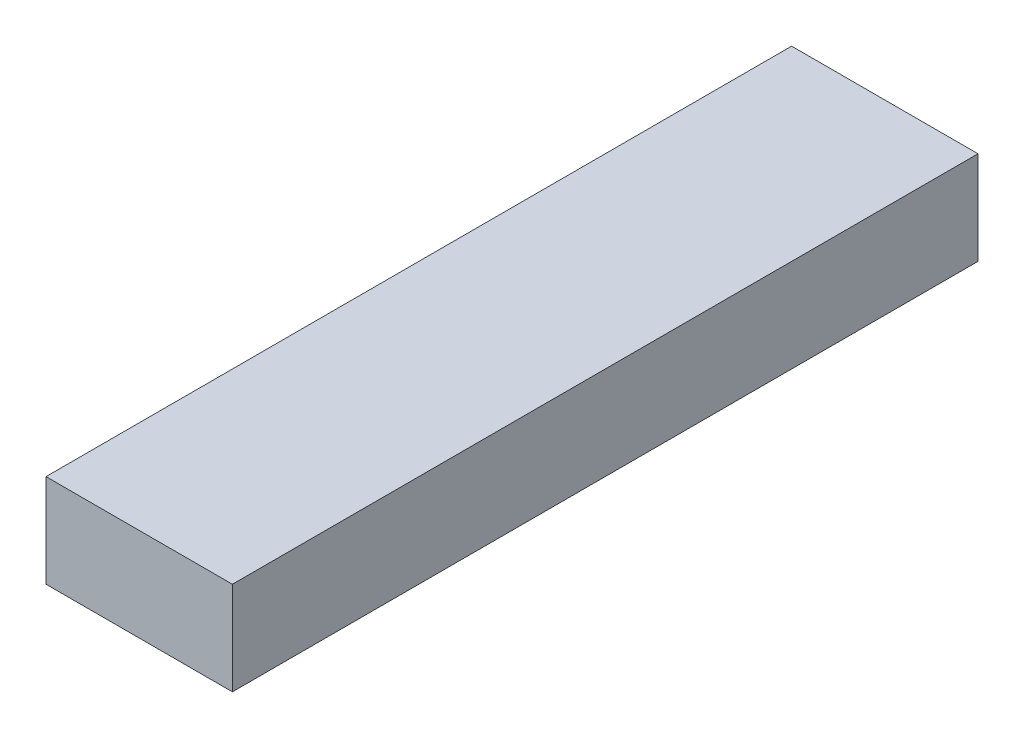
from build123d import *

# Parameters (mm, degrees)
SKETCH1_W           = 304.8
SKETCH1_H           = 304.8
BOSS_EXTRUDE1_DEPTH = 6.35
CUT_EXTRUDE2_DEPTH  = 6.35


with BuildPart() as part:
    # Sketch1 → Boss-Extrude1 (new body)
    with BuildSketch(Plane(origin=(0, 0, 0), x_dir=(1, 0, 0), z_dir=(0, 1, 0))):
        with Locations((152.4, 152.4)):
            Rectangle(SKETCH1_W, SKETCH1_H)
    extrude(amount=BOSS_EXTRUDE1_DEPTH)

    # Sketch2 → Cut-Extrude2 (cut)
    with BuildSketch(Plane(origin=(0, 6.35, 0), x_dir=(1, 0, 0), z_dir=(0, 1, 0))):
        Polygon((12.7, 304.8), (12.7, 254), (0, 254), (0, 0), (304.8, 0), (304.8, 304.8), align=None)
    extrude(amount=-CUT_EXTRUDE2_DEPTH, mode=Mode.SUBTRACT)


solid = part.part
